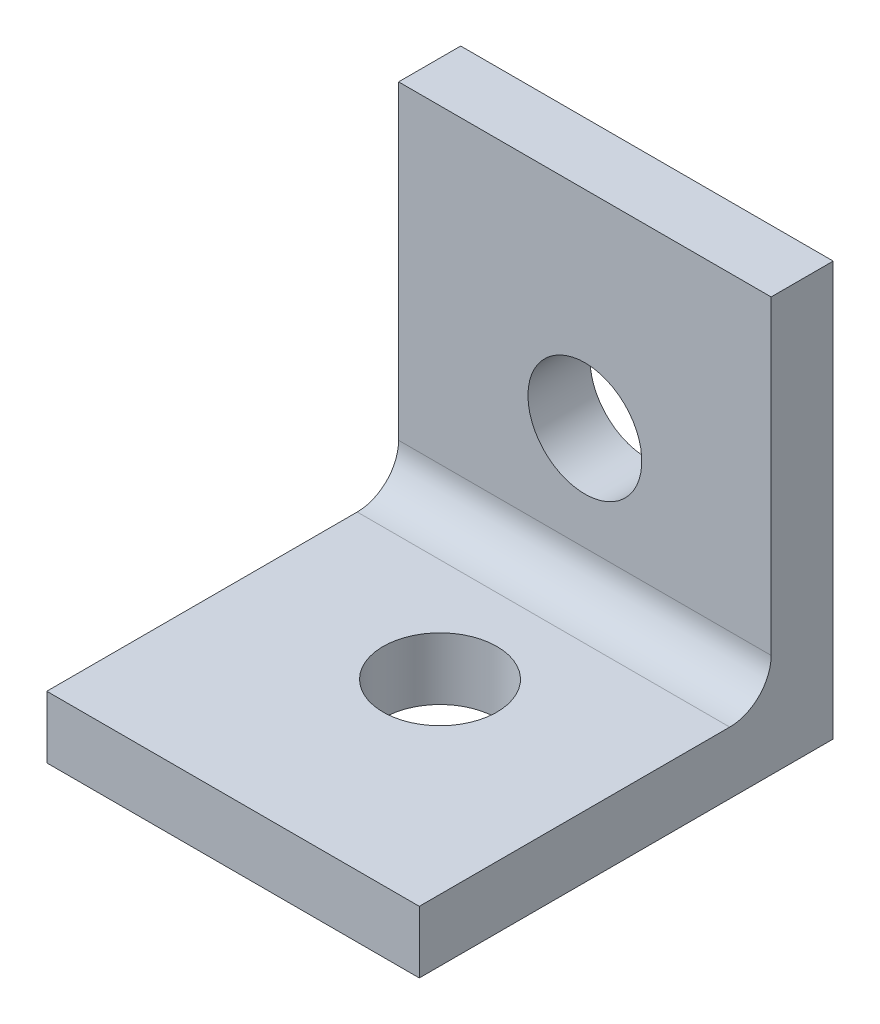
from build123d import *

# Parameters (mm, degrees)
SKETCH_1_W      = 18
SKETCH_1_H      = 20
EXTRUDE_1_DEPTH = 3
SKETCH_2_W      = 18
SKETCH_2_H      = 3
EXTRUDE_2_DEPTH = 17
HOLE_WIZARD_1_D = 5.5
HOLE_WIZARD_2_D = 5.5
FILLET_1_R      = 2


with BuildPart() as part:
    # 草图1 → 凸台-拉伸1 (new body)
    with BuildSketch(Plane(origin=(0, 0, 0), x_dir=(1, 0, 0), z_dir=(0, 1, 0))):
        with Locations((9, 10)):
            Rectangle(SKETCH_1_W, SKETCH_1_H)
    extrude(amount=EXTRUDE_1_DEPTH)

    # 草图2 → 凸台-拉伸2 (add)
    with BuildSketch(Plane(origin=(0, 3, 0), x_dir=(1, 0, 0), z_dir=(0, 1, 0))):
        with Locations((9, 18.5)):
            Rectangle(SKETCH_2_W, SKETCH_2_H)
    extrude(amount=EXTRUDE_2_DEPTH)

    # 孔1 (through all)
    with Locations(Plane(origin=(0, 0, 0), x_dir=(-1, 0, 0), z_dir=(0, -1, 0))):
        with Locations((-9, 10)):
            Hole(HOLE_WIZARD_1_D / 2)

    # 孔2 (through all)
    with Locations(Plane(origin=(0, 0, -20), x_dir=(-1, 0, 0), z_dir=(0, 0, -1))):
        with Locations((-9, 10)):
            Hole(HOLE_WIZARD_2_D / 2)

    # 圆角1
    fillet_1_edges = [part.edges().sort_by_distance(p)[0] for p in [
        (9, 3, -17),
    ]]
    fillet(fillet_1_edges, radius=FILLET_1_R)


solid = part.part
